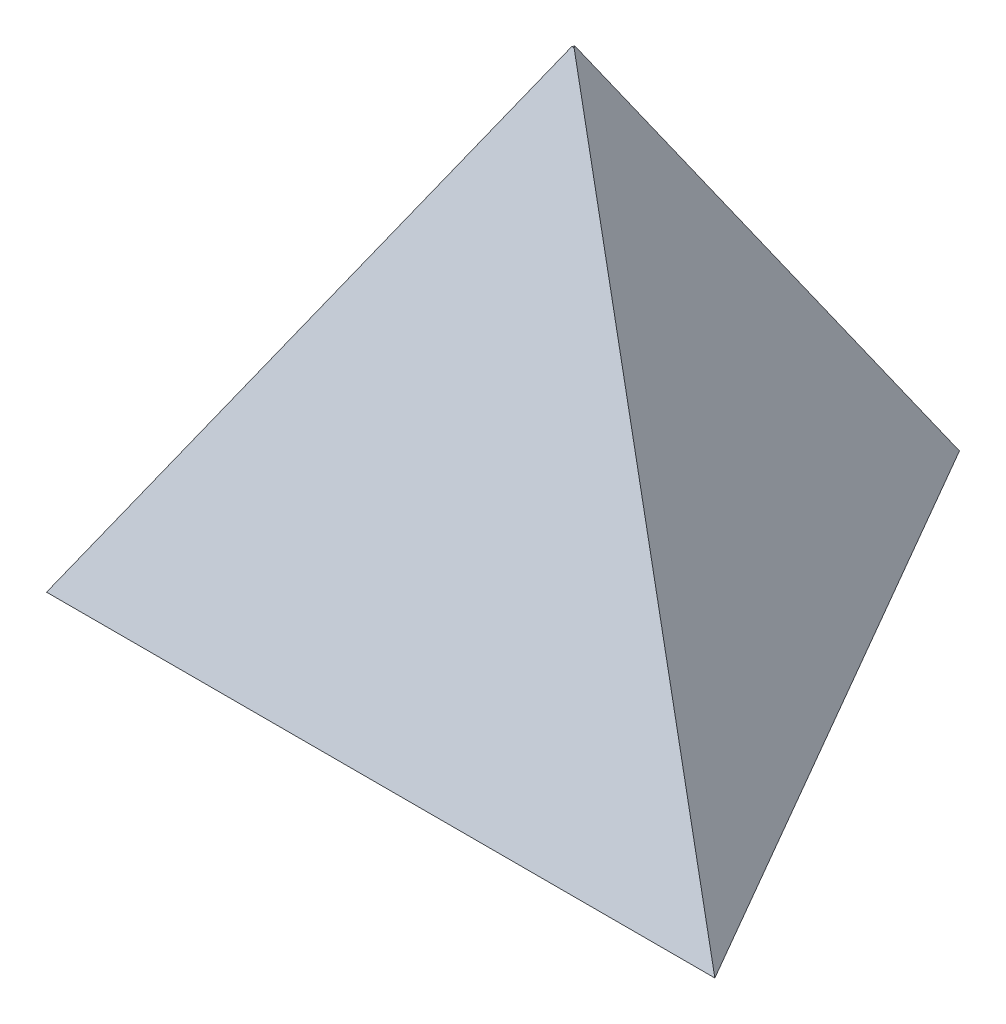
from build123d import *

# Parameters (mm, degrees)
BOSS_EXTRUDE1_DEPTH = 65
BOSS_EXTRUDE1_TAPER = 19.5
SHELL1_T            = -2


with BuildPart() as part:
    # Sketch1 → Boss-Extrude1 (new body)
    with BuildSketch(Plane(origin=(0, 0, 0), x_dir=(1, 0, 0), z_dir=(0, 1, 0))):
        Polygon((40, -23.094010768), (0, 46.188021535), (-40, -23.094010768), align=None)
    extrude(amount=BOSS_EXTRUDE1_DEPTH, taper=BOSS_EXTRUDE1_TAPER)

    # Shell1
    shell1_openings = [part.faces().sort_by_distance(p)[0] for p in [
        (0, 0, 0),
    ]]
    offset(amount=SHELL1_T, openings=shell1_openings)


solid = part.part
